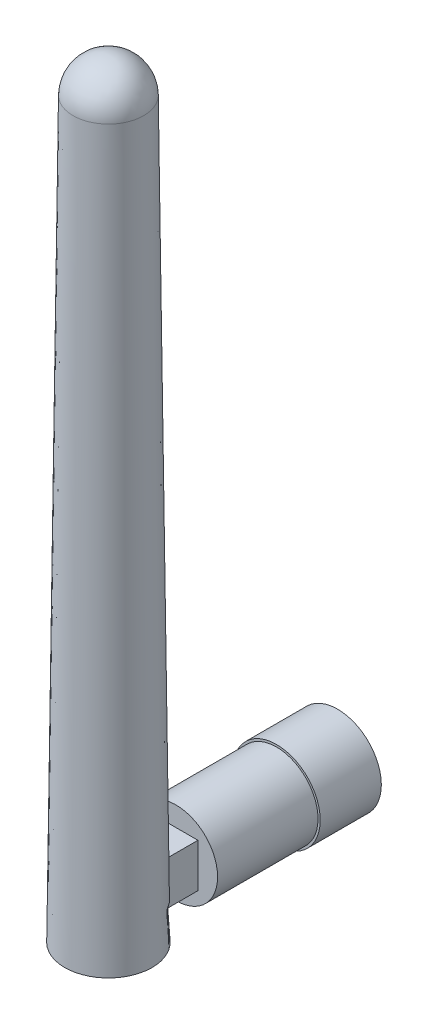
from build123d import *

# Parameters (mm, degrees)
SKETCH1_R           = 5
BOSS_EXTRUDE1_DEPTH = 7
SKETCH2_R           = 4.75
BOSS_EXTRUDE2_DEPTH = 11.5
SKETCH5_W           = 5
SKETCH5_H           = 5
BOSS_EXTRUDE3_DEPTH = 10.5
SKETCH6_W           = 5
SKETCH6_H           = 10.5
CUT_EXTRUDE1_DEPTH  = 2.5


with BuildPart() as part:
    # Sketch1 → Boss-Extrude1 (new body)
    with BuildSketch(Plane.XY):
        Circle(SKETCH1_R)
    extrude(amount=BOSS_EXTRUDE1_DEPTH)

    # Sketch2 → Boss-Extrude2 (add)
    with BuildSketch(Plane.XY.offset(7)):
        Circle(SKETCH2_R)
    extrude(amount=BOSS_EXTRUDE2_DEPTH)



with BuildPart() as body_2:
    # Sketch4 → Revolve2 (revolve)
    with BuildSketch(Plane.XY.offset(26.25), mode=Mode.PRIVATE) as revolve2_sk:
        with BuildLine():
            Line((0, -5), (-5, -5))
            Line((-5, -5), (-4.045451611, 79.000258239))
            ThreePointArc((-4.045451611, 79.000258239), (-2.844451304, 81.831245462), (0, 83))
            Line((0, 83), (0, -5))
        make_face()
    revolve(revolve2_sk.sketch.rotate(Axis((0, -1000, 26.25), (0, 1, 0)), 180), axis=Axis((0, -1000, 26.25), (0, 1, 0)))


with BuildPart() as part_1:
    add(part.part)

    add(body_2.part)  # Boss-Extrude3 merges body 2
    # Sketch5 → Boss-Extrude3 (add)
    with BuildSketch(Plane.XY.offset(18.5)):
        Rectangle(SKETCH5_W, SKETCH5_H)
    extrude(amount=BOSS_EXTRUDE3_DEPTH)

    # Sketch6 → Cut-Extrude1 (cut)
    with BuildSketch(Plane.XZ.offset(5)):
        with Locations((0, 23.75)):
            Rectangle(SKETCH6_W, SKETCH6_H)
    extrude(amount=-CUT_EXTRUDE1_DEPTH, mode=Mode.SUBTRACT)


solid = part_1.part
